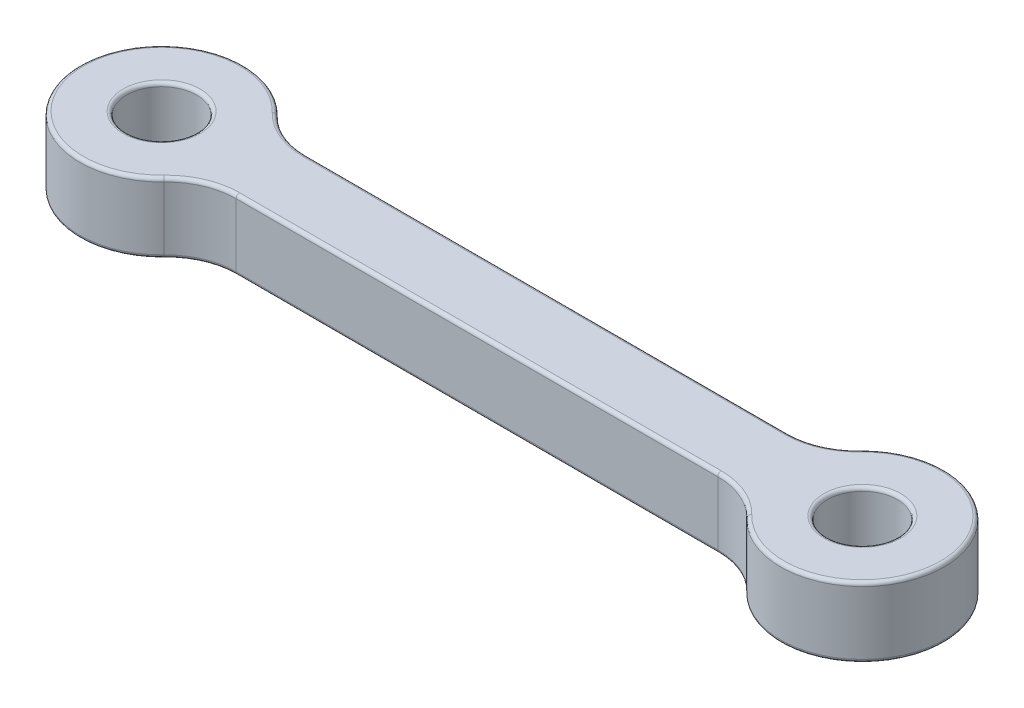
from build123d import *

# Parameters (mm, degrees)
SKETCH_1_R      = 1.5
EXTRUDE_1_DEPTH = 3
FILLET_1_R      = 3
FILLET_2_R      = 0.15


with BuildPart() as part:
    # 草图1 → 凸台-拉伸1 (new body)
    with BuildSketch(Plane(origin=(0, 0, 0), x_dir=(1, 0, 0), z_dir=(0, 1, 0))):
        with BuildLine():
            Line((-11.83772234, 1.5), (11.83772234, 1.5))
            ThreePointArc((11.83772234, 1.5), (18.5, 0), (11.83772234, -1.5))
            Line((11.83772234, -1.5), (-11.83772234, -1.5))
            ThreePointArc((-11.83772234, -1.5), (-18.5, 0), (-11.83772234, 1.5))
        make_face()
        with Locations(Location((-15, 0, 0), (0, 0, 270))):
            Circle(SKETCH_1_R, mode=Mode.SUBTRACT)
        with Locations(Location((15, 0, 0), (0, 0, 90))):
            Circle(SKETCH_1_R, mode=Mode.SUBTRACT)
    extrude(amount=EXTRUDE_1_DEPTH)

    # 圆角1
    fillet_1_edges = [part.edges().sort_by_distance(p)[0] for p in [
        (-11.83772234, 1.5, -1.5),
        (11.83772234, 1.5, -1.5),
        (11.83772234, 1.5, 1.5),
        (-11.83772234, 1.5, 1.5),
    ]]
    fillet(fillet_1_edges, radius=FILLET_1_R)

    # 圆角2
    fillet_2_edges = [part.edges().sort_by_distance(p)[0] for p in [
        (-15, 3, -1.5),
        (15, 0, 1.5),
        (15, 3, 1.5),
        (18.5, 0, 0),
        (18.5, 3, 0),
        (0, 0, 1.5),
        (0, 3, 1.5),
        (-18.5, 0, 0),
        (-18.5, 3, 0),
        (0, 0, -1.5),
        (0, 3, -1.5),
        (11.486281051, 0, 1.740401367),
        (11.486281051, 3, 1.740401367),
        (-11.486281051, 0, 1.740401367),
        (-11.486281051, 3, 1.740401367),
        (-11.486281051, 0, -1.740401367),
        (-11.486281051, 3, -1.740401367),
        (11.486281051, 0, -1.740401367),
        (11.486281051, 3, -1.740401367),
    ]]
    fillet(fillet_2_edges, radius=FILLET_2_R)


solid = part.part
